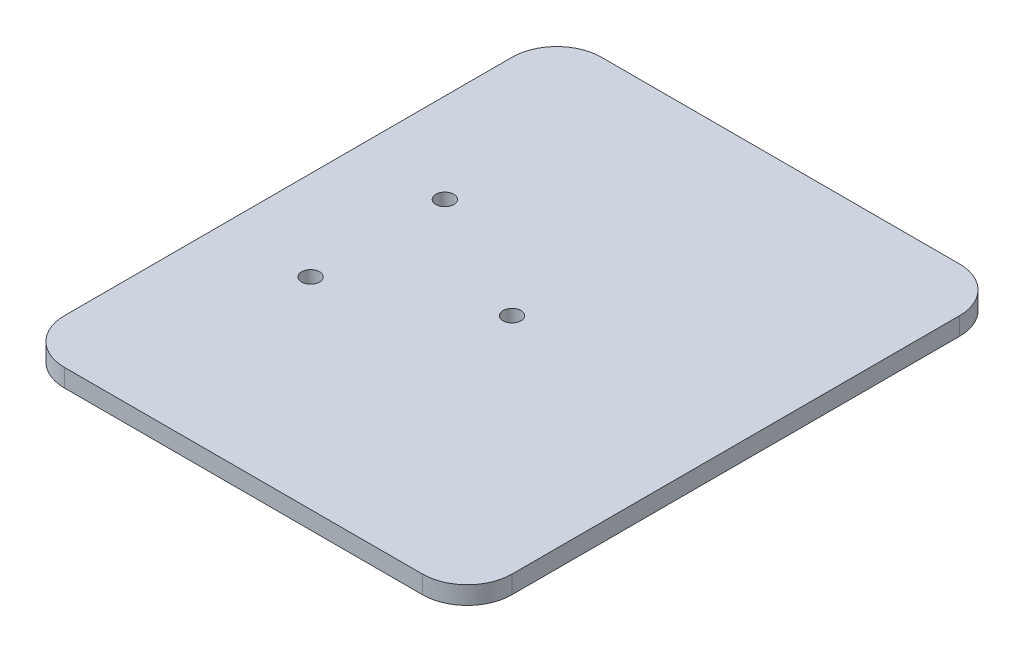
from build123d import *

# Parameters (mm, degrees)
SKETCH1_R           = 1
BOSS_EXTRUDE1_DEPTH = 2


with BuildPart() as part:
    # Sketch1 → Boss-Extrude1 (new body)
    with BuildSketch(Plane(origin=(0, 0, 0), x_dir=(1, 0, 0), z_dir=(0, 1, 0))):
        with BuildLine():
            Line((-52.254901961, 26.274509804), (-12.254901961, 26.274509804))
            ThreePointArc((-12.254901961, 26.274509804), (-8.719368055, 24.81004371), (-7.254901961, 21.274509804))
            Line((-7.254901961, 21.274509804), (-7.254901961, -28.725490196))
            ThreePointArc((-7.254901961, -28.725490196), (-8.719368055, -32.261024102), (-12.254901961, -33.725490196))
            Line((-12.254901961, -33.725490196), (-52.254901961, -33.725490196))
            ThreePointArc((-52.254901961, -33.725490196), (-55.790435867, -32.261024102), (-57.254901961, -28.725490196))
            Line((-57.254901961, -28.725490196), (-57.254901961, 21.274509804))
            ThreePointArc((-57.254901961, 21.274509804), (-55.790435867, 24.81004371), (-52.254901961, 26.274509804))
        make_face()
        with Locations(Location((-32.254901961, -3.725490196, 0), (0, 0, 270))):
            Circle(SKETCH1_R, mode=Mode.SUBTRACT)
        with Locations(Location((-47.254901961, 3.774509804, 0), (0, 0, 270))):
            Circle(SKETCH1_R, mode=Mode.SUBTRACT)
        with Locations(Location((-47.254901961, -11.225490196, 0), (0, 0, 270))):
            Circle(SKETCH1_R, mode=Mode.SUBTRACT)
    extrude(amount=BOSS_EXTRUDE1_DEPTH)


solid = part.part
